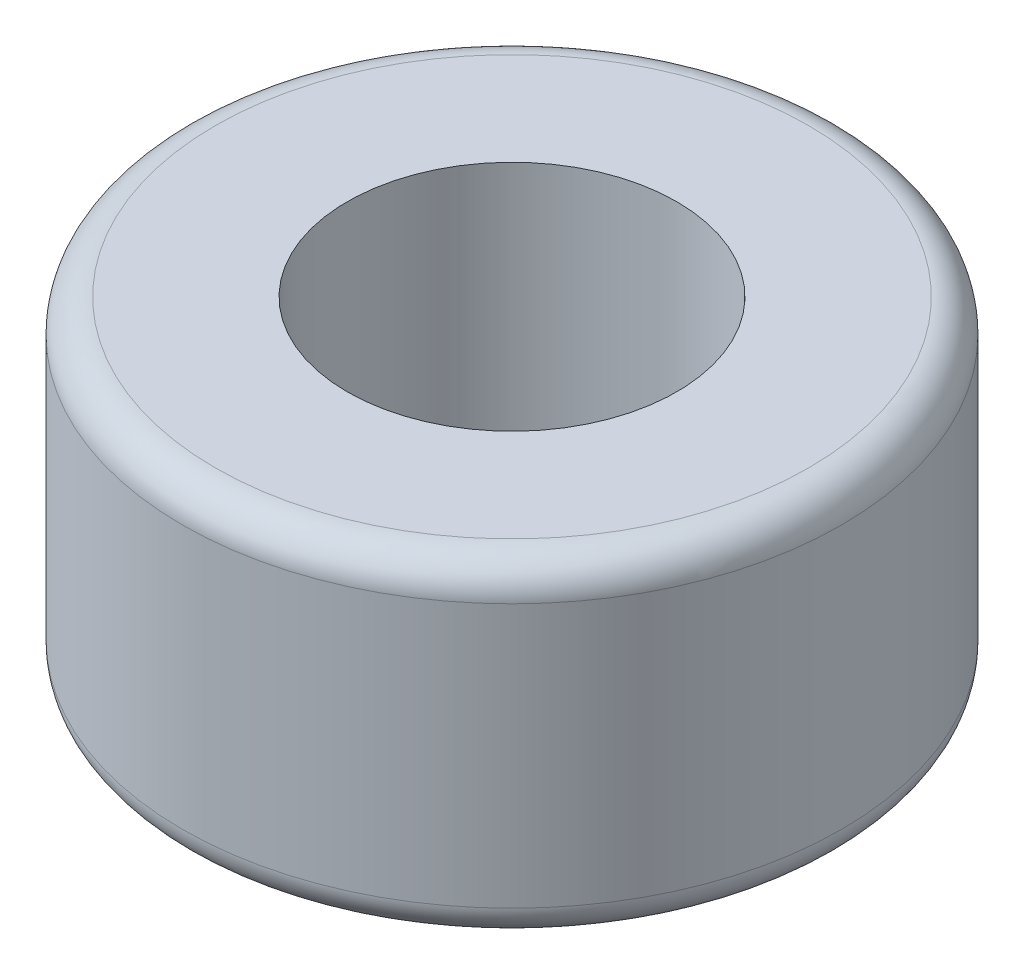
from build123d import *

# Parameters (mm, degrees)
SKETCH1_R           = 1
SKETCH1_R_2         = 0.5
BOSS_EXTRUDE1_DEPTH = 1
FILLET1_R           = 0.1
FILLET2_R           = 0.1


with BuildPart() as part:
    # Sketch1 → Boss-Extrude1 (new body)
    with BuildSketch(Plane(origin=(0, 0, 0), x_dir=(1, 0, 0), z_dir=(0, 1, 0))):
        with Locations(Location((0, 0, 0), (0, 0, 270))):
            Circle(SKETCH1_R)
        with Locations(Location((0, 0, 0), (0, 0, 270))):
            Circle(SKETCH1_R_2, mode=Mode.SUBTRACT)
    extrude(amount=BOSS_EXTRUDE1_DEPTH)

    # Fillet1
    fillet1_edges = [part.edges().sort_by_distance(p)[0] for p in [
        (0, 1, -1),
    ]]
    fillet(fillet1_edges, radius=FILLET1_R)

    # Fillet2
    fillet2_edges = [part.edges().sort_by_distance(p)[0] for p in [
        (0, 0, -1),
    ]]
    fillet(fillet2_edges, radius=FILLET2_R)


solid = part.part
